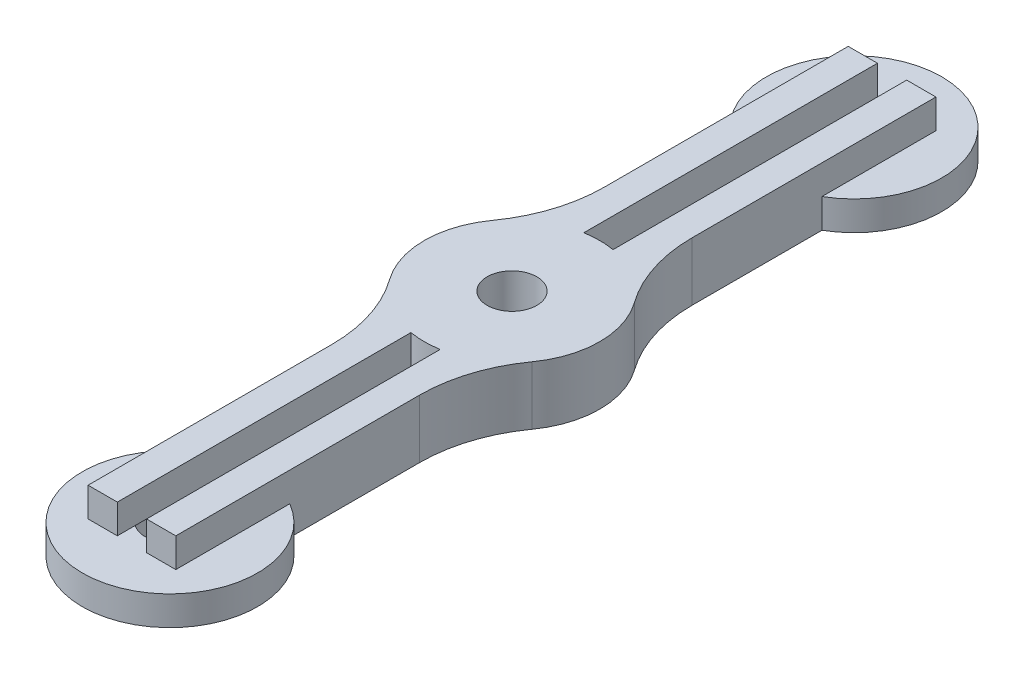
from build123d import *

# Parameters (mm, degrees)
SKETCH1_R           = 1.6999999999999986
SKETCH1_R_2         = 1.7
BOSS_EXTRUDE1_DEPTH = 2
BOSS_EXTRUDE2_DEPTH = 2
SKETCH3_R           = 6.000000000000001
SKETCH3_R_2         = 1.7
BOSS_EXTRUDE3_DEPTH = 2
FILLET1_R           = 10
FILLET2_R           = 10


with BuildPart() as part:
    # Sketch1 → Boss-Extrude1 (new body)
    with BuildSketch(Plane(origin=(0, 0, 0), x_dir=(1, 0, 0), z_dir=(0, 1, 0))):
        with BuildLine():
            Line((-2.999999999999997, -5.196152422706636), (-2.9999999999999973, -18.20384757729328))
            ThreePointArc((-2.9999999999999045, -18.203847577293313), (-2.417e-14, -29.400000000000006), (2.9999999999999534, -18.20384757729334))
            Line((3.0000000000000027, -18.20384757729332), (3.000000000000003, -5.196152422706632))
            ThreePointArc((3.0000000000000027, -5.196152422706631), (-3.11e-15, 6), (-2.9999999999999973, -5.196152422706634))
        make_face()
        with Locations(Location((-5e-16, -23.400000000000002, 0), (0, 0, 270))):
            Circle(SKETCH1_R, mode=Mode.SUBTRACT)
        with Locations(Location((0, 0, 0), (0, 0, 270))):
            Circle(SKETCH1_R_2, mode=Mode.SUBTRACT)
    boss_extrude1 = extrude(amount=BOSS_EXTRUDE1_DEPTH)

    # Sketch2 → Boss-Extrude2 (add)
    with BuildSketch(Plane(origin=(0, 2, 0), x_dir=(1, 0, 0), z_dir=(0, 1, 0))):
        Polygon((-2.999999999999997, -26.000000000000004), (-2.9999999999999964, -5.196152422706635), (-0.9999999999999996, -5.196152422706635), (-0.999999999999997, -26.000000000000004), align=None)
        Polygon((3.000000000000003, -26.000000000000004), (1.000000000000003, -26.000000000000004), (1.000000000000003, -5.196152422706631), (3.0000000000000027, -5.196152422706631), align=None)
    boss_extrude2 = extrude(amount=BOSS_EXTRUDE2_DEPTH)

    # Sketch3 → Boss-Extrude3 (add)
    with BuildSketch(Plane(origin=(0, 2, 0), x_dir=(1, 0, 0), z_dir=(0, 1, 0))):
        Circle(SKETCH3_R)
        with Locations(Location((0, 0, 0), (0, 0, 270))):
            Circle(SKETCH3_R_2, mode=Mode.SUBTRACT)
    extrude(amount=BOSS_EXTRUDE3_DEPTH)

    # Fillet1
    fillet1_edges = [part.edges().sort_by_distance(p)[0] for p in [
        (-2.999999999999997, 2, 5.196152422706636),
        (3.0000000000000027, 2, 5.196152422706631),
    ]]
    fillet(fillet1_edges, radius=FILLET1_R)

    # Mirror1: Boss-Extrude1, Boss-Extrude2 across plane
    add(boss_extrude1.mirror(Plane.XY))
    add(boss_extrude2.mirror(Plane.XY))

    # Fillet2
    fillet2_edges = [part.edges().sort_by_distance(p)[0] for p in [
        (3.0000000000000027, 2, -5.196152422706631),
        (-2.999999999999997, 2, -5.196152422706636),
    ]]
    fillet(fillet2_edges, radius=FILLET2_R)


solid = part.part
